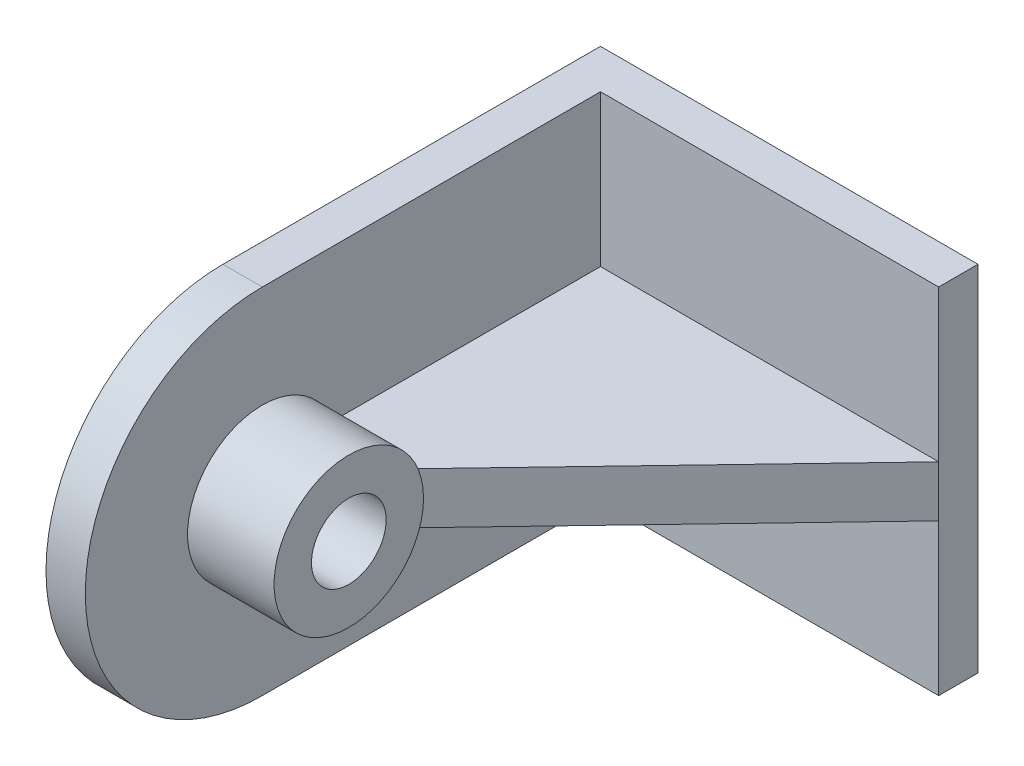
from build123d import *

# Parameters (mm, degrees)
SKETCH1_W           = 90
SKETCH1_H           = 96
BOSS_EXTRUDE1_DEPTH = 10
BOSS_EXTRUDE2_DEPTH = 10
SKETCH3_R           = 19
SKETCH3_R_2         = 9.5
BOSS_EXTRUDE3_DEPTH = 22
RIB1_REACH          = 157.596
SKETCH4_WALL_W      = 405.846534596
SKETCH4_WALL_H      = 13


with BuildPart() as part:
    # Sketch1 → Boss-Extrude1 (new body)
    with BuildSketch(Plane(origin=(0, 0, 0), x_dir=(0, 1, 0), z_dir=(0, 0, 1))):
        Rectangle(SKETCH1_W, SKETCH1_H)
    extrude(amount=BOSS_EXTRUDE1_DEPTH)

    # Sketch2 → Boss-Extrude2 (add)
    with BuildSketch(Plane(origin=(-48, 0, 0), x_dir=(0, -1, 0), z_dir=(-1, 0, 0))):
        with BuildLine():
            Line((-45, 0), (-45, 96))
            ThreePointArc((-45, 96), (0, 141), (45, 96))
            Line((45, 96), (45, 0))
            Line((45, 0), (-45, 0))
        make_face()
    extrude(amount=-BOSS_EXTRUDE2_DEPTH)

    # Sketch3 → Boss-Extrude3 (add)
    with BuildSketch(Plane.YZ.offset(-38)):
        with Locations(Location((0, 96, 0), (0, 0, 270))):
            Circle(SKETCH3_R)
        with Locations(Location((0, 96, 0), (0, 0, 270))):
            Circle(SKETCH3_R_2, mode=Mode.SUBTRACT)
    extrude(amount=BOSS_EXTRUDE3_DEPTH)

    # Sketch4 wall → Rib1 (add, up to next)
    with BuildSketch(Plane(origin=(16, 0, 43.5), x_dir=(-0.6907323943, 0, 0.723110475283), z_dir=(0.723110475283, 0, 0.6907323943)), mode=Mode.PRIVATE) as rib1_sk1:
        Rectangle(SKETCH4_WALL_W, SKETCH4_WALL_H)
    rib1_tool1 = extrude(rib1_sk1.sketch, amount=-RIB1_REACH, mode=Mode.PRIVATE) - part.part
    add(rib1_tool1.solids().sort_by_distance((16, 0, 43.5))[0])


solid = part.part
